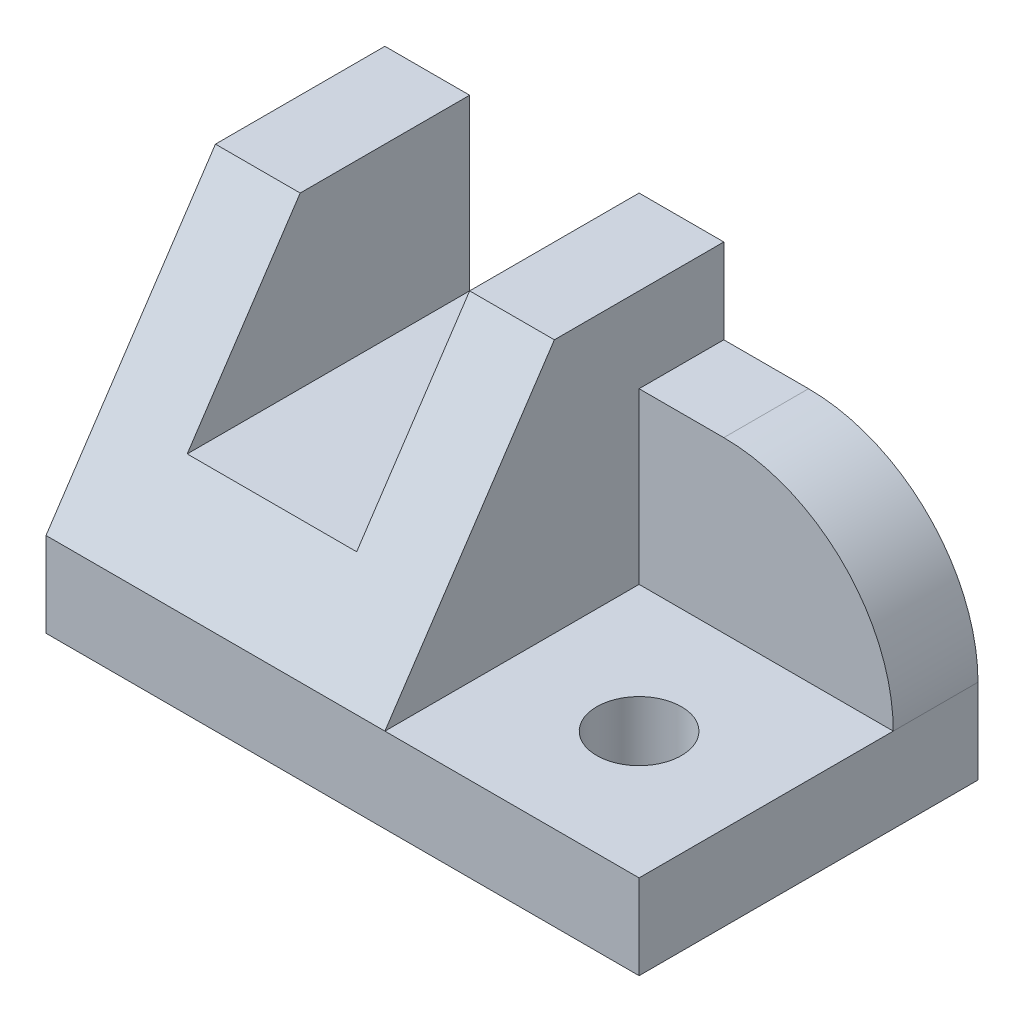
from build123d import *

# Parameters (mm, degrees)
BOSS_EXTRUDE1_DEPTH = 10
BOSS_EXTRUDE2_DEPTH = 40
CHAMFER1_SIZE       = 30
CHAMFER1_SIZE2      = 20
SKETCH2_R           = 5
CUT_EXTRUDE1_DEPTH  = 87.02325267


with BuildPart() as part:
    # Sketch1 → Boss-Extrude1 (new body)
    with BuildSketch(Plane.XY):
        with BuildLine():
            Line((40, -10), (40, -30))
            Line((40, -30), (70, -30))
            ThreePointArc((70, -30), (64.142135624, -15.857864376), (50, -10))
            Line((50, -10), (40, -10))
        make_face()
    extrude(amount=BOSS_EXTRUDE1_DEPTH)

    # Sketch1<3> → Boss-Extrude2 (add)
    with BuildSketch(Plane.XY):
        Polygon((10, 0), (0, 0), (0, -40), (70, -40), (70, -30), (40, -30), (40, 0), (30, 0), (30, -20), (10, -20), align=None)
    extrude(amount=BOSS_EXTRUDE2_DEPTH)

    # Chamfer1
    chamfer1_edges = [part.edges().sort_by_distance(p)[0] for p in [
        (35, 0, 40),
    ]]
    chamfer1_side = [part.faces().sort_by_distance(p)[0] for p in [
        (27, -25.666666667, 40),
    ]]
    chamfer(chamfer1_edges, length=CHAMFER1_SIZE, length2=CHAMFER1_SIZE2, reference=chamfer1_side[0])

    # Sketch2 → Cut-Extrude1 (cut, through all)
    with BuildSketch(Plane(origin=(0, -30, 0), x_dir=(1, 0, 0), z_dir=(0, 1, 0))):
        with Locations((55, -25)):
            Circle(SKETCH2_R)
    extrude(amount=-CUT_EXTRUDE1_DEPTH, mode=Mode.SUBTRACT)


solid = part.part
